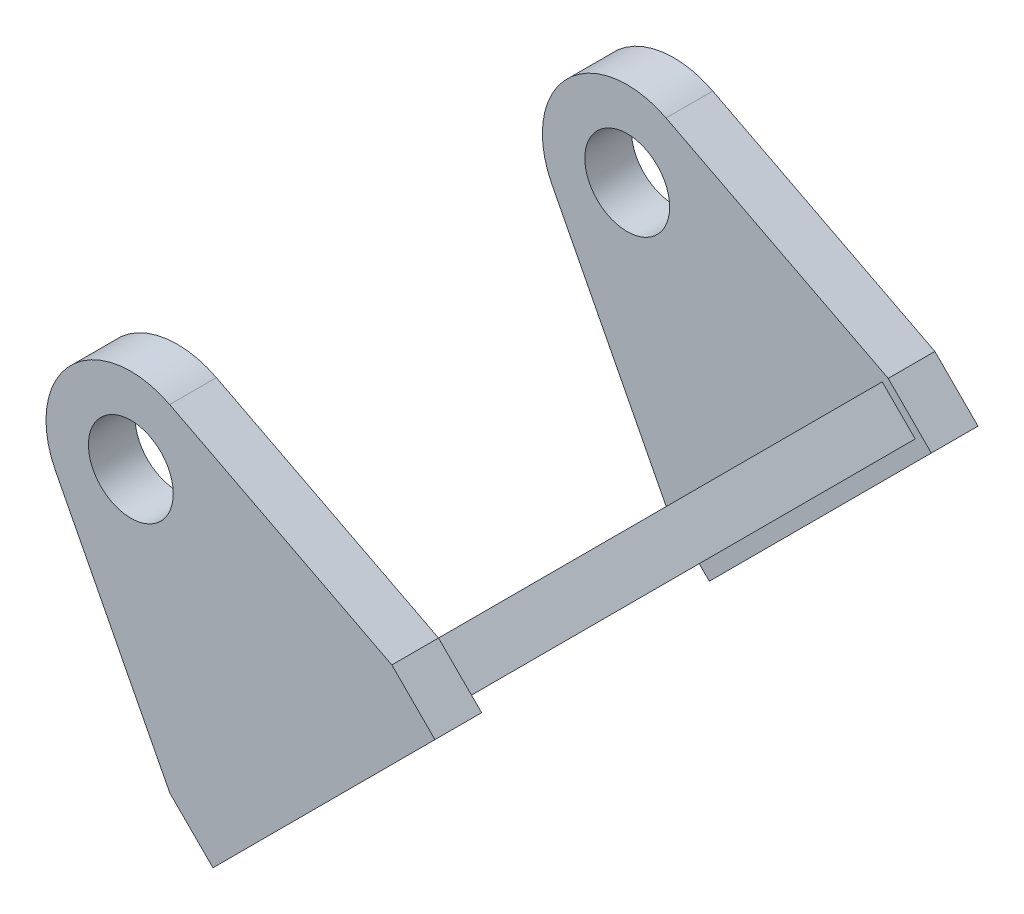
from build123d import *

# Parameters (mm, degrees)
EXTRUDE_1_DEPTH     = 27
EXTRUDE_START       = -0.5
SKETCH_3_R          = 5
EXTRUDE_2_DEPTH     = 5.5
SKETCH_4_R          = 2.5
CUT_EXTRUDE_1_DEPTH = 10


with BuildPart() as part:
    # ｽｹｯﾁ1 → ﾎﾞｽ - 押し出し1 (new, symmetric)
    with BuildSketch(Plane.XY):
        Polygon((0, 0), (3.889087297, -3.889087297), (28.637824638, 20.859650045), (24.748737342, 24.748737342), align=None)
    extrude(amount=EXTRUDE_1_DEPTH, both=True)

    # ｽｹｯﾁ4 → ｶｯﾄ - 押し出し1 (cut)
    with BuildSketch(Plane(origin=(0, 0, 0), x_dir=(0, 0, 1), z_dir=(-0.7071067811865486, 0.7071067811865465, 0))):
        with Locations(Location((8, 28.5, 0), (0, 0, 270))):
            Circle(SKETCH_4_R)
        with Locations(Location((-1, 6.5, 0), (0, 0, 270))):
            Circle(SKETCH_4_R)
    extrude(amount=-CUT_EXTRUDE_1_DEPTH, mode=Mode.SUBTRACT)


with BuildPart() as body_2:
    # ｽｹｯﾁ3 → ﾎﾞｽ - 押し出し2 (new body)
    with BuildSketch(Plane.XY.offset(27).offset(EXTRUDE_START)):
        with BuildLine():
            Line((-0.707106781, -0.707106781), (-14.193116952, 25.472609216))
            ThreePointArc((-14.193116952, 25.472609216), (-12.374368671, 37.123106012), (-0.723871874, 38.941854294))
            Line((-0.723871874, 38.941854294), (25.455844123, 25.455844123))
            Line((25.455844123, 25.455844123), (30.538984259, 20.372703986))
            Line((30.538984259, 20.372703986), (4.376033356, -5.790246918))
            Line((4.376033356, -5.790246918), (-0.707106781, -0.707106781))
        make_face()
        with Locations((-5.303300859, 30.0520382)):
            Circle(SKETCH_3_R, mode=Mode.SUBTRACT)
    extrude(amount=EXTRUDE_2_DEPTH)


with BuildPart() as body_3:
    # ﾐﾗｰ1: mirrored copy
    add(body_2.part.mirror(Plane.XY))


solid = Compound([part.part, body_2.part, body_3.part])
